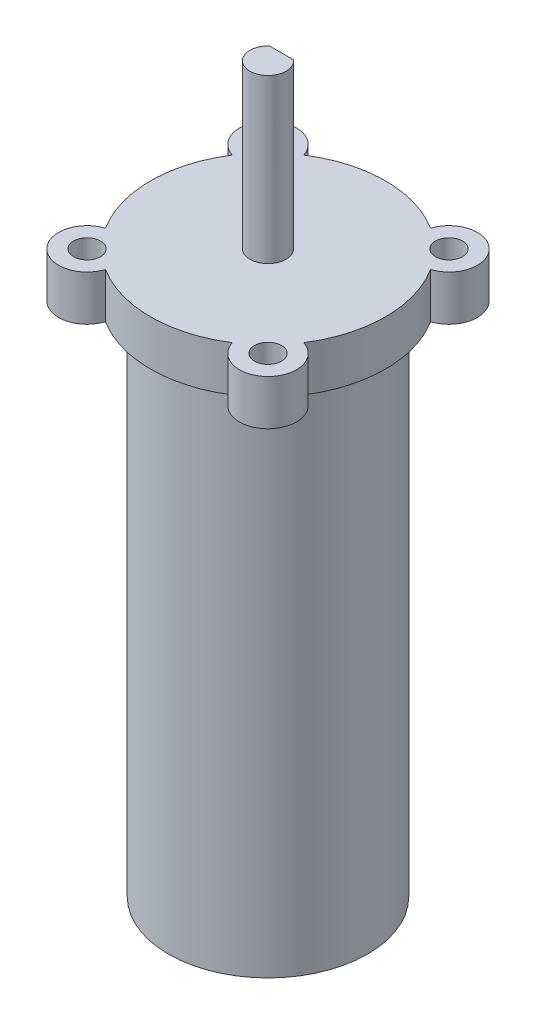
from build123d import *

# Parameters (mm, degrees)
SKETCH1_R      = 11
EXTRUDE1_DEPTH = 62
SKETCH2_R      = 2
EXTRUDE2_DEPTH = 18
SKETCH3_R      = 1.5
SKETCH3_R_2    = 11
EXTRUDE3_DEPTH = 62
SKETCH4_R      = 20.921238725
SKETCH4_R_2    = 11
EXTRUDE4_DEPTH = 57
EXTRUDE5_START = -12
EXTRUDE5_DEPTH = 12


with BuildPart() as part:
    # Sketch1 → Extrude1 (new body)
    with BuildSketch(Plane(origin=(0, 0, 0), x_dir=(1, 0, 0), z_dir=(0, 1, 0))):
        with Locations(Location((0, 0, 0), (0, 0, 270))):
            Circle(SKETCH1_R)
    extrude(amount=EXTRUDE1_DEPTH)

    # Sketch2 → Extrude2 (add)
    with BuildSketch(Plane(origin=(0, 62, 0), x_dir=(1, 0, 0), z_dir=(0, 1, 0))):
        with Locations(Location((0, 0, 0), (0, 0, 270))):
            Circle(SKETCH2_R)
    extrude(amount=EXTRUDE2_DEPTH)

    # Sketch3 → Extrude3 (add)
    with BuildSketch(Plane.XZ):
        with BuildLine():
            ThreePointArc((10.951086395, -7.005262792), (13, 0), (10.951086395, 7.005262792))
            ThreePointArc((10.951086395, 7.005262792), (12.221825407, 12.221825407), (7.005262792, 10.951086395))
            ThreePointArc((7.005262792, 10.951086395), (0, 13), (-7.005262792, 10.951086395))
            ThreePointArc((-7.005262792, 10.951086395), (-12.221825407, 12.221825407), (-10.951086395, 7.005262792))
            ThreePointArc((-10.951086395, 7.005262792), (-13, 0), (-10.951086395, -7.005262792))
            ThreePointArc((-10.951086395, -7.005262792), (-12.221825407, -12.221825407), (-7.005262792, -10.951086395))
            ThreePointArc((-7.005262792, -10.951086395), (0, -13), (7.005262792, -10.951086395))
            ThreePointArc((7.005262792, -10.951086395), (12.221825407, -12.221825407), (10.951086395, -7.005262792))
        make_face()
        with Locations(Location((10, -10, 0), (0, 0, 270))):
            Circle(SKETCH3_R, mode=Mode.SUBTRACT)
        with Locations(Location((10, 10, 0), (0, 0, 270))):
            Circle(SKETCH3_R, mode=Mode.SUBTRACT)
        with Locations(Location((-10, 10, 0), (0, 0, 270))):
            Circle(SKETCH3_R, mode=Mode.SUBTRACT)
        with Locations(Location((-10, -10, 0), (0, 0, 270))):
            Circle(SKETCH3_R, mode=Mode.SUBTRACT)
        Circle(SKETCH3_R_2, mode=Mode.SUBTRACT)
    extrude(amount=-EXTRUDE3_DEPTH)

    # Sketch4 → Extrude4 (cut)
    with BuildSketch(Plane.XZ):
        Circle(SKETCH4_R)
        with Locations(Location((0, 0, 0), (0, 0, 270))):
            Circle(SKETCH4_R_2, mode=Mode.SUBTRACT)
    extrude(amount=-EXTRUDE4_DEPTH, mode=Mode.SUBTRACT)

    # Sketch5 → Extrude5 (cut)
    with BuildSketch(Plane(origin=(0, 80, 0), x_dir=(1, 0, 0), z_dir=(0, 1, 0)).offset(EXTRUDE5_START)):
        with BuildLine():
            Line((-1.322875656, 1.5), (1.322875656, 1.5))
            ThreePointArc((1.322875656, 1.5), (0, 2), (-1.322875656, 1.5))
        make_face()
    extrude(amount=EXTRUDE5_DEPTH, mode=Mode.SUBTRACT)


solid = part.part
